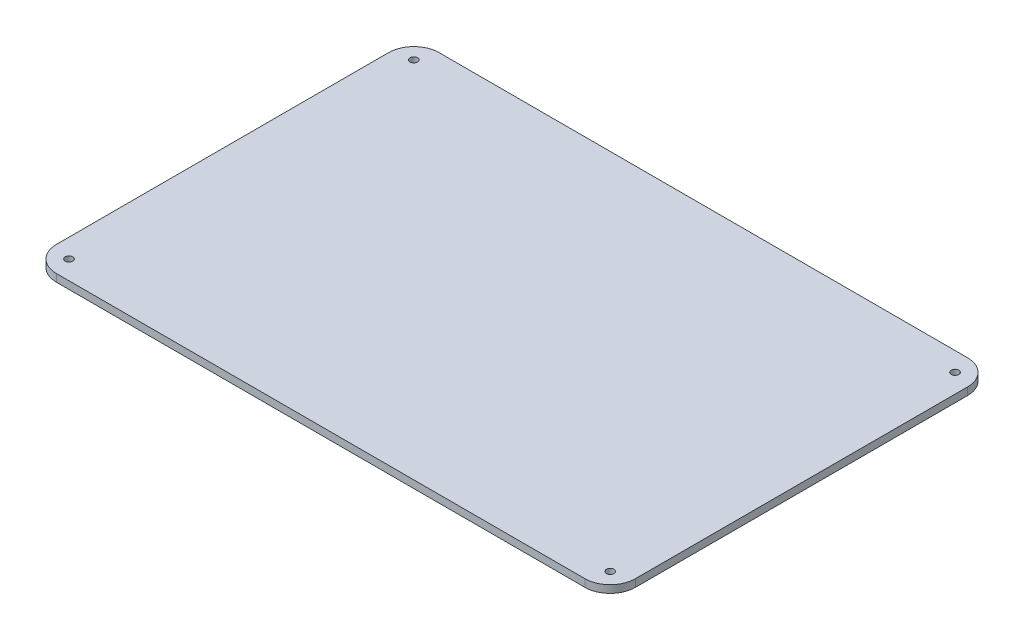
from build123d import *

# Parameters (mm, degrees)
SKETCH_1_W          = 230
SKETCH_1_H          = 152
EXTRUDE_1_DEPTH     = 3
SKETCH_2_R          = 1.5
CUT_EXTRUDE_1_DEPTH = 3
FILLET_1_R          = 10


with BuildPart() as part:
    # Эскиз1 → Бобышка-Вытянуть1 (new body)
    with BuildSketch(Plane(origin=(0, 0, 0), x_dir=(1, 0, 0), z_dir=(0, 1, 0))):
        with Locations((-38.903225806, -30.5)):
            Rectangle(SKETCH_1_W, SKETCH_1_H)
    extrude(amount=EXTRUDE_1_DEPTH)

    # Эскиз2 → Вырез-Вытянуть1 (cut)
    with BuildSketch(Plane(origin=(0, 3, 0), x_dir=(1, 0, 0), z_dir=(0, 1, 0))):
        with Locations(Location((-146.403225806, 38, 0), (0, 0, 270))):
            Circle(SKETCH_2_R)
        with Locations(Location((68.596774194, 38, 0), (0, 0, 270))):
            Circle(SKETCH_2_R)
        with Locations(Location((68.596774194, -99, 0), (0, 0, 270))):
            Circle(SKETCH_2_R)
        with Locations(Location((-146.403225806, -99, 0), (0, 0, 270))):
            Circle(SKETCH_2_R)
    extrude(amount=-CUT_EXTRUDE_1_DEPTH, mode=Mode.SUBTRACT)

    # Скругление1
    fillet_1_edges = [part.edges().sort_by_distance(p)[0] for p in [
        (-153.903225806, 1.5, -45.5),
        (76.096774194, 1.5, -45.5),
        (76.096774194, 1.5, 106.5),
        (-153.903225806, 1.5, 106.5),
    ]]
    fillet(fillet_1_edges, radius=FILLET_1_R)


solid = part.part
